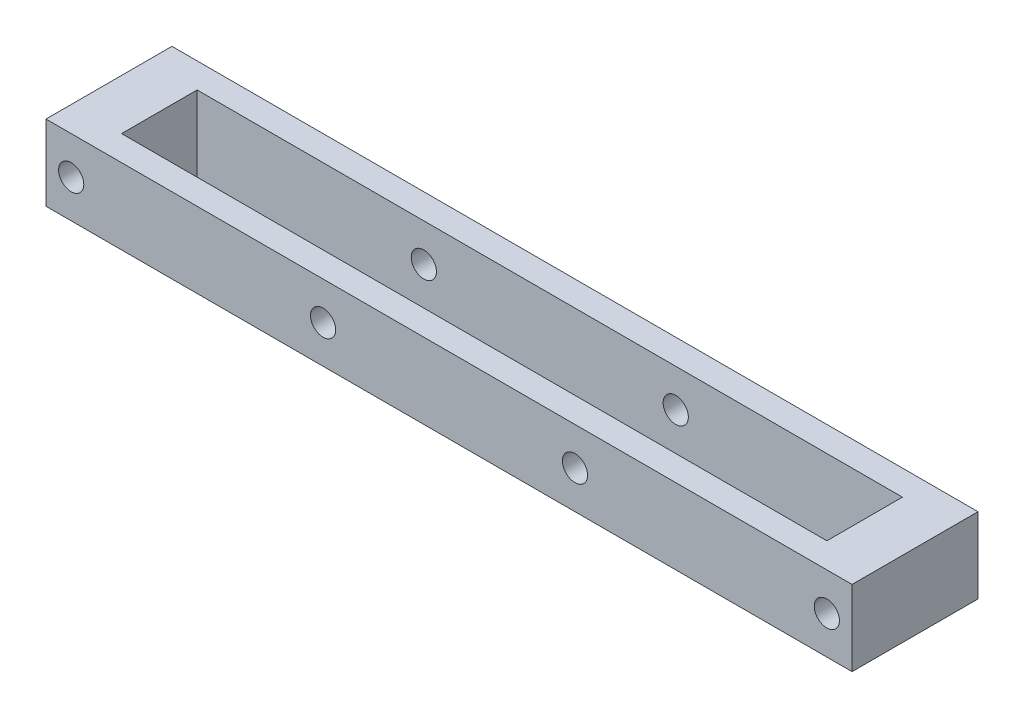
from build123d import *

# Parameters (mm, degrees)
SKETCH1_W               = 320
SKETCH1_H               = 30
BOSS_EXTRUDE1_DEPTH     = 25
SKETCH2_W               = 280
SKETCH2_H               = 30
CUT_EXTRUDE1_DEPTH      = 25
CUT_EXTRUDE3_DEPTH      = 163.634559673
CUT_EXTRUDE3_DEPTH_BACK = 163.634559673
SKETCH3_R               = 5


with BuildPart() as part:
    # Sketch1 → Boss-Extrude1 (new, symmetric)
    with BuildSketch(Plane.XY):
        Rectangle(SKETCH1_W, SKETCH1_H)
    extrude(amount=BOSS_EXTRUDE1_DEPTH, both=True)

    # Sketch2 → Cut-Extrude1 (cut, symmetric)
    with BuildSketch(Plane(origin=(0, 0, 0), x_dir=(1, 0, 0), z_dir=(0, 1, 0))):
        Rectangle(SKETCH2_W, SKETCH2_H)
    extrude(amount=CUT_EXTRUDE1_DEPTH, both=True, mode=Mode.SUBTRACT)

    # Sketch3 → Cut-Extrude3 (cut, two sides: drawn at the far end of the back side and taken through both)
    with BuildSketch(Plane.XY.offset(-CUT_EXTRUDE3_DEPTH_BACK)):
        with Locations((-150, 0)):
            Circle(SKETCH3_R)
        with Locations((150, 0)):
            Circle(SKETCH3_R)
        with Locations((-50, 0)):
            Circle(SKETCH3_R)
        with Locations((50, 0)):
            Circle(SKETCH3_R)
    extrude(amount=CUT_EXTRUDE3_DEPTH + CUT_EXTRUDE3_DEPTH_BACK, mode=Mode.SUBTRACT)


solid = part.part
